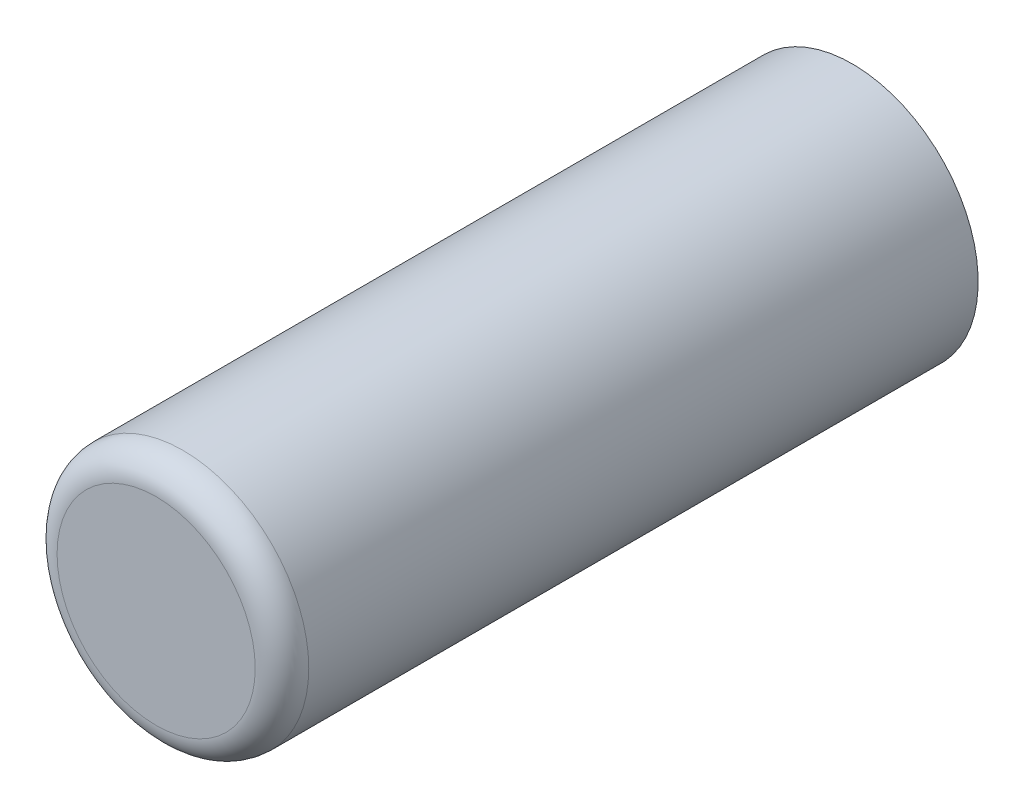
from build123d import *

# Parameters (mm, degrees)
SKIZZE1_R                       = 2.35
AUFSATZ_LINEAR_AUSTRAGEN1_DEPTH = 13
VERRUNDUNG1_R                   = 0.5


with BuildPart() as part:
    # Skizze1 → Aufsatz-Linear austragen1 (new body)
    with BuildSketch(Plane.XY):
        with Locations(Location((0, 0, 0), (0, 0, 180))):
            Circle(SKIZZE1_R)
    extrude(amount=AUFSATZ_LINEAR_AUSTRAGEN1_DEPTH)

    # Verrundung1
    verrundung1_edges = [part.edges().sort_by_distance(p)[0] for p in [
        (2.35, 0, 13),
    ]]
    fillet(verrundung1_edges, radius=VERRUNDUNG1_R)


solid = part.part
